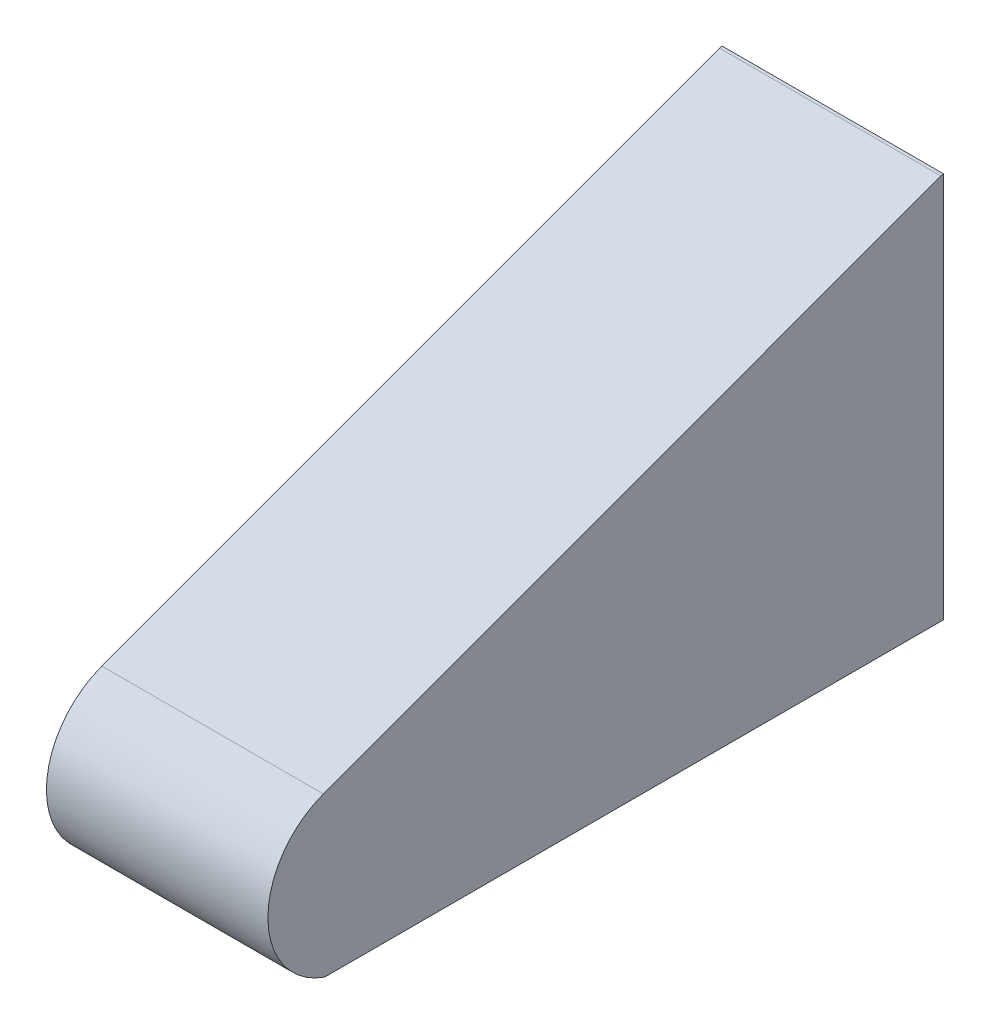
from build123d import *

# Parameters (mm, degrees)
BOSS_EXTRUDE1_DEPTH      = 63.5
BOSS_EXTRUDE1_DEPTH_BACK = 63.5
BOSS_EXTRUDE2_DEPTH      = 4.826


with BuildPart() as part:
    # Sketch1 → Boss-Extrude1 (new, two sides: drawn at the far end of the back side and taken through both)
    with BuildSketch(Plane(origin=(0, 0, 0), x_dir=(0, 0, -1), z_dir=(1, 0, 0)).offset(-BOSS_EXTRUDE1_DEPTH_BACK)):
        with BuildLine():
            Line((0, -114.3), (-381, -114.3))
            ThreePointArc((-381, -114.3), (-412.045495931, -69.85), (-381, -25.4))
            Line((-381, -25.4), (0, 114.3))
            Line((0, 114.3), (0, 119.126))
            Line((0, 119.126), (-1.661372937, 118.8310171))
            Line((-1.661372937, 118.8310171), (-382.661372937, -20.8689829))
            ThreePointArc((-382.661372937, -20.8689829), (-416.86965301, -70.288504669), (-381.835461036, -119.126))
            Line((-381.835461036, -119.126), (0, -119.126))
            Line((0, -119.126), (0, -114.3))
        make_face()
    extrude(amount=BOSS_EXTRUDE1_DEPTH + BOSS_EXTRUDE1_DEPTH_BACK)

    # Sketch2 → Boss-Extrude2 (add)
    with BuildSketch(Plane(origin=(63.5, 0, 0), x_dir=(0, 0, -1), z_dir=(1, 0, 0))):
        with BuildLine():
            Line((-381.835461036, -119.126), (0, -119.126))
            Line((0, -119.126), (0, 119.126))
            Line((0, 119.126), (-1.661372937, 118.8310171))
            Line((-1.661372937, 118.8310171), (-382.661372937, -20.8689829))
            ThreePointArc((-382.661372937, -20.8689829), (-416.86965301, -70.288504669), (-381.835461036, -119.126))
        make_face()
    boss_extrude2 = extrude(amount=BOSS_EXTRUDE2_DEPTH)

    # Mirror1: Boss-Extrude2 across plane
    add(boss_extrude2.mirror(Plane(origin=(0, 0, 0), x_dir=(0, 0, 1), z_dir=(1, 0, 0))))


solid = part.part
